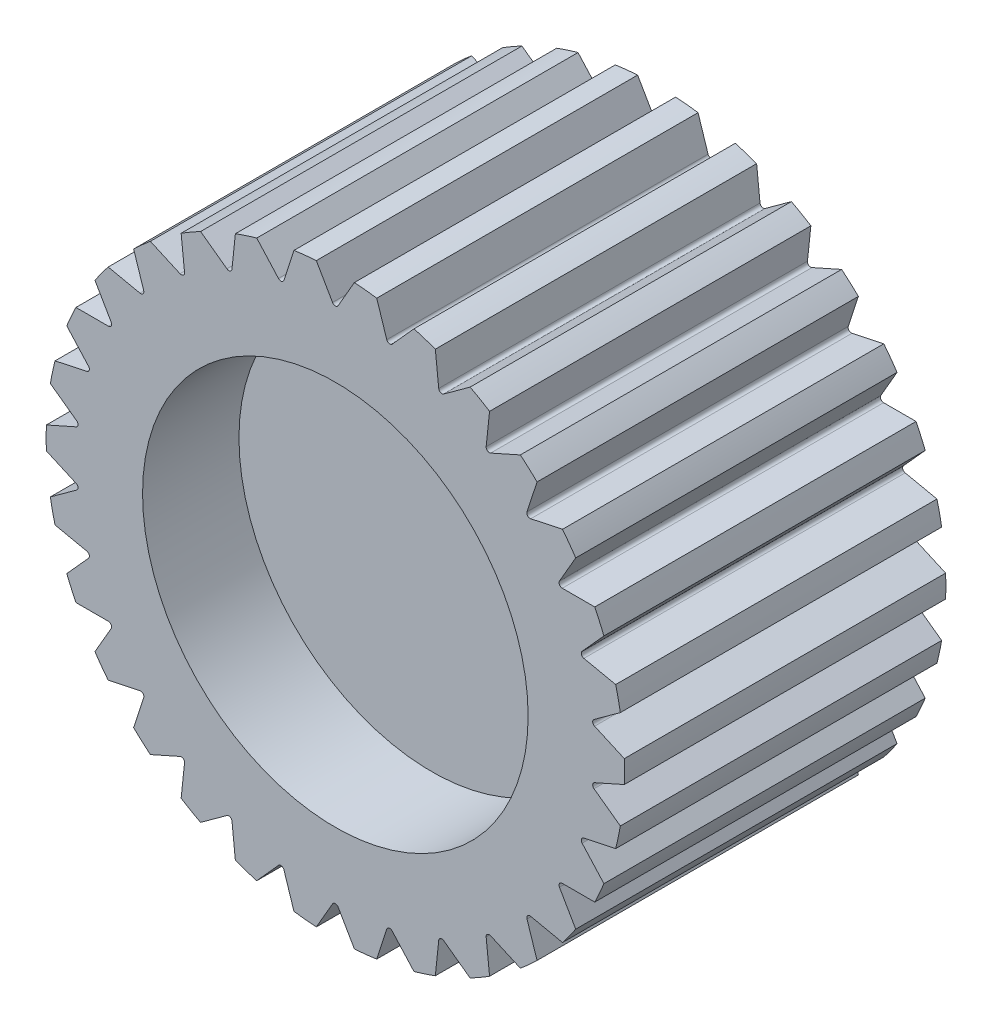
from build123d import *

# Parameters (mm, degrees)
SKETCH1_R           = 9
BOSS_EXTRUDE1_DEPTH = 10
SKETCH2_R           = 6
CUT_EXTRUDE1_DEPTH  = 3
CUT_EXTRUDE2_DEPTH  = 17.186414056
CIRPATTERN1_COUNT   = 30


with BuildPart() as part:
    # Sketch1 → Boss-Extrude1 (new body)
    with BuildSketch(Plane.XY):
        Circle(SKETCH1_R)
    extrude(amount=BOSS_EXTRUDE1_DEPTH)

    # Sketch2 → Cut-Extrude1 (cut)
    with BuildSketch(Plane.XY.offset(10)):
        Circle(SKETCH2_R)
    extrude(amount=-CUT_EXTRUDE1_DEPTH, mode=Mode.SUBTRACT)

    # Sketch3 → Cut-Extrude2 (cut, through all)
    with BuildSketch(Plane.XY.offset(10)):
        with BuildLine():
            Line((-1.633345226, 10.785436843), (1.633345226, 10.785436843))
            Line((1.633345226, 10.785436843), (0.6, 8.994081534))
            Line((0.6, 8.994081534), (0.086621258, 8.104113968))
            ThreePointArc((0.086621258, 8.104113968), (0, 8.054081534), (-0.086621258, 8.104113968))
            Line((-0.086621258, 8.104113968), (-0.6, 8.994081534))
            Line((-0.6, 8.994081534), (-1.633345226, 10.785436843))
        make_face()
    cut_extrude2 = extrude(amount=-CUT_EXTRUDE2_DEPTH, mode=Mode.SUBTRACT)

    # CirPattern1: Cut-Extrude2 ×30 about axis
    cirpattern1_axis = Axis((0, 0, 0), (0, 0, 1))
    for i in range(1, CIRPATTERN1_COUNT):
        add(cut_extrude2.rotate(cirpattern1_axis, i * 360 / CIRPATTERN1_COUNT), mode=Mode.SUBTRACT)


solid = part.part
